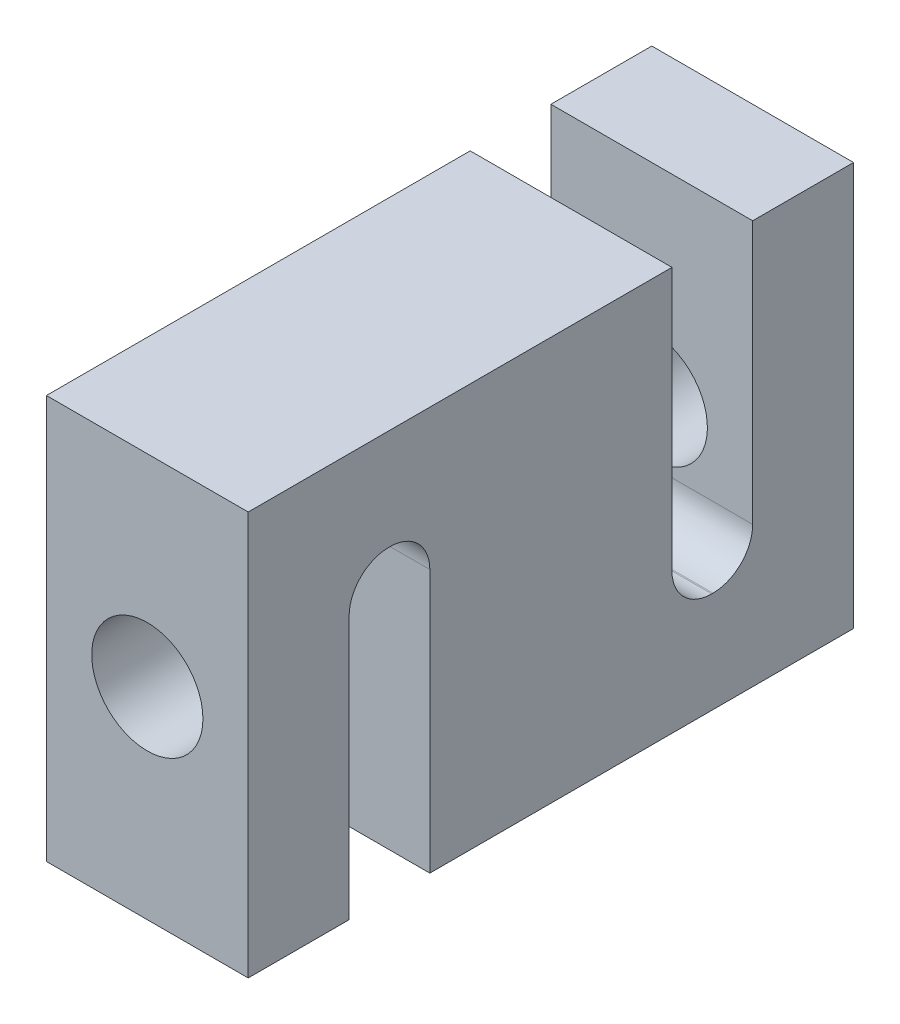
from build123d import *

# Parameters (mm, degrees)
SKETCH1_W                        = 25.4
SKETCH1_H                        = 50.8
BOSS_EXTRUDE1_DEPTH              = 76.2
SKETCH2_W                        = 10.16
SKETCH2_H                        = 38.1
CUT_EXTRUDE1_DEPTH               = 115.016182683
TAP_DRILL_FOR_M16X2_0_TAP2_D     = 14
TAP_DRILL_FOR_M16X2_0_TAP2_DEPTH = 12.7
TAP_DRILL_FOR_M16X2_0_TAP1_D     = 14
TAP_DRILL_FOR_M16X2_0_TAP1_DEPTH = 12.7
FILLET1_R                        = 5


with BuildPart() as part:
    # Sketch1 → Boss-Extrude1 (new body)
    with BuildSketch(Plane.XY):
        with Locations((-2.344226023, 55.520268868)):
            Rectangle(SKETCH1_W, SKETCH1_H)
    extrude(amount=BOSS_EXTRUDE1_DEPTH)

    # Sketch2 → Cut-Extrude1 (cut, through all)
    with BuildSketch(Plane.ZY.offset(15.044226023)):
        with Locations((17.78, 61.870268868)):
            Rectangle(SKETCH2_W, SKETCH2_H)
        with Locations((58.42, 49.170268868)):
            Rectangle(SKETCH2_W, SKETCH2_H)
    extrude(amount=-CUT_EXTRUDE1_DEPTH, mode=Mode.SUBTRACT)

    # Tap Drill for M16x2.0 Tap2
    with Locations(Plane(origin=(0, 0, 0), x_dir=(-1, 0, 0), z_dir=(0, 0, -1))):
        with Locations((2.344226023, 55.520268868)):
            Hole(TAP_DRILL_FOR_M16X2_0_TAP2_D / 2, depth=TAP_DRILL_FOR_M16X2_0_TAP2_DEPTH)

    # Tap Drill for M16x2.0 Tap1
    with Locations(Plane.XY.offset(76.2)):
        with Locations((-2.344226023, 55.520268868)):
            Hole(TAP_DRILL_FOR_M16X2_0_TAP1_D / 2, depth=TAP_DRILL_FOR_M16X2_0_TAP1_DEPTH)

    # Fillet1
    fillet1_edges = [part.edges().sort_by_distance(p)[0] for p in [
        (-2.344226023, 42.820268868, 12.7),
        (-2.344226023, 42.820268868, 22.86),
        (-2.344226023, 68.220268868, 53.34),
        (-2.344226023, 68.220268868, 63.5),
    ]]
    fillet(fillet1_edges, radius=FILLET1_R)


solid = part.part
